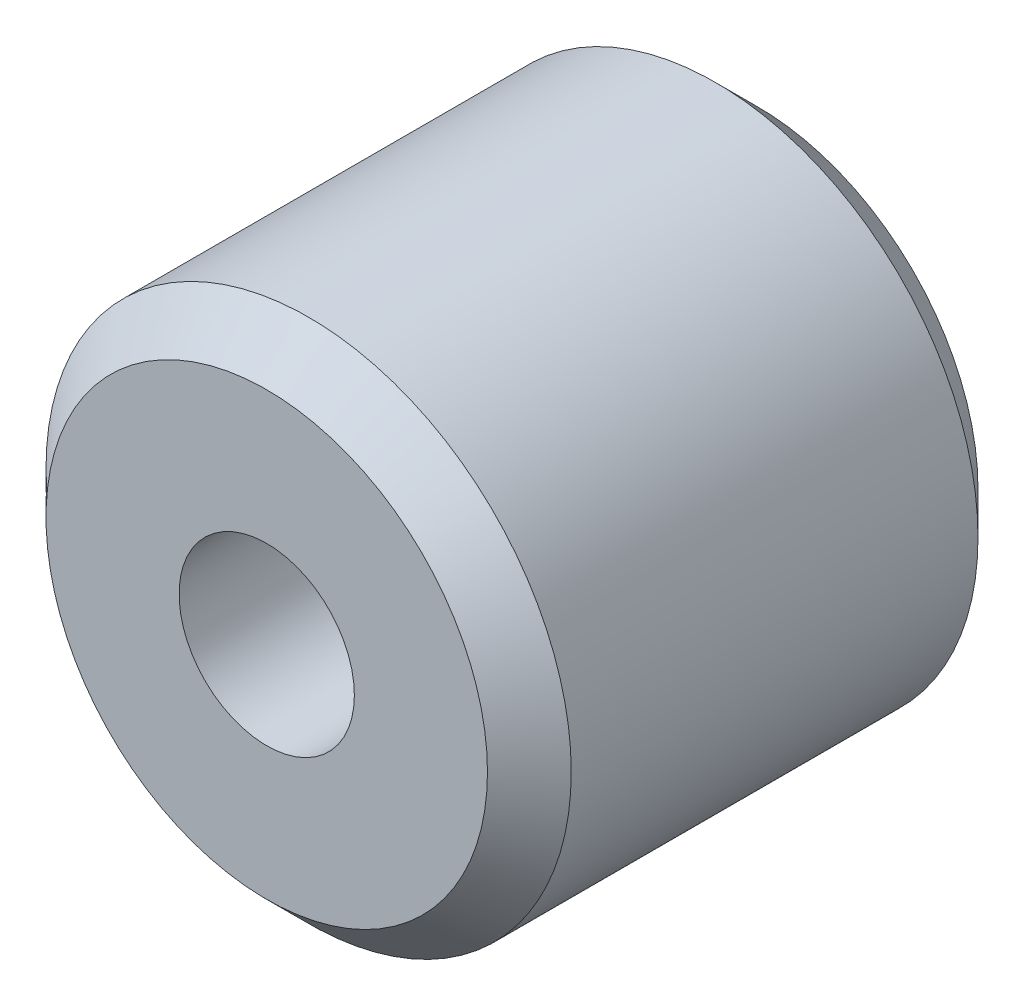
from build123d import *

# Parameters (mm, degrees)
SKETCH1_R           = 4.765
SKETCH1_R_2         = 1.59
BOSS_EXTRUDE1_DEPTH = 4.45
CHAMFER1_SIZE       = 0.76


with BuildPart() as part:
    # Sketch1 → Boss-Extrude1 (new, symmetric)
    with BuildSketch(Plane.XY):
        Circle(SKETCH1_R)
        Circle(SKETCH1_R_2, mode=Mode.SUBTRACT)
    extrude(amount=BOSS_EXTRUDE1_DEPTH, both=True)

    # Chamfer1
    chamfer1_edges = [part.edges().sort_by_distance(p)[0] for p in [
        (-4.765, 0, -4.45),
        (-4.765, 0, 4.45),
    ]]
    chamfer(chamfer1_edges, length=CHAMFER1_SIZE)


solid = part.part
